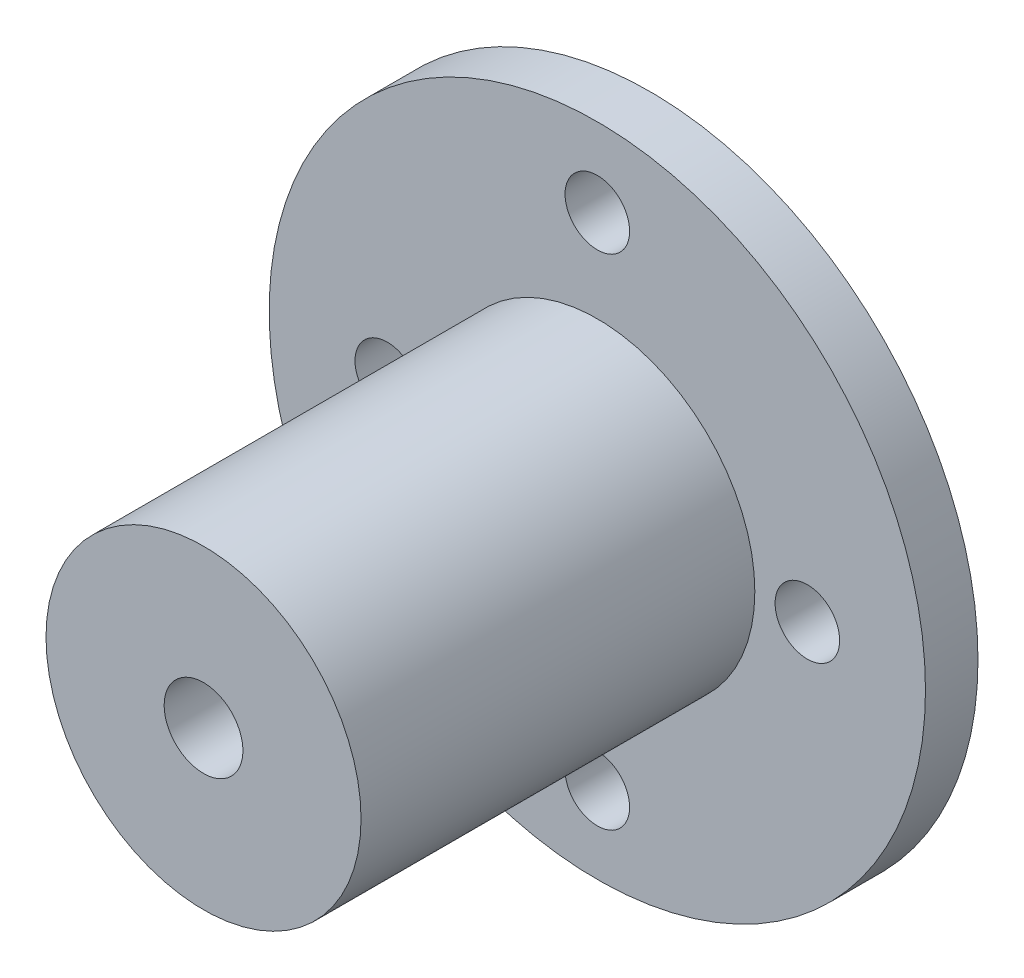
from build123d import *

# Parameters (mm, degrees)
ESQUISSE1_W                   = 12.5
ESQUISSE1_H                   = 2
ESQUISSE2_R                   = 6
BOSS_EXTRU_1_DEPTH            = 15
DIAM_TRE_DU_PER_AGE_3_0_3_1_D = 3
D_GAGEMENT_M21_D              = 2.459
D_GAGEMENT_M21_DEPTH          = 17


with BuildPart() as part:
    # Esquisse1 → Révolution1 (revolve)
    with BuildSketch(Plane(origin=(0, 152.70275651, 0), x_dir=(1, 0, 0), z_dir=(0, 1, 0))):
        with Locations((177.420752313, -1)):
            Rectangle(ESQUISSE1_W, ESQUISSE1_H)
    revolve(axis=Axis((171.170752313, 152.70275651, 0), (0, 0, 1)))

    # Esquisse2 → Boss.-Extru.1 (add)
    with BuildSketch(Plane.XY.offset(2)):
        with Locations((171.170752313, 152.70275651)):
            Circle(ESQUISSE2_R)
    extrude(amount=BOSS_EXTRU_1_DEPTH)

    # Diamètre du perçage Ø3.0 (3)1 (through all)
    with Locations(Plane(origin=(0, 0, 0), x_dir=(-1, 0, 0), z_dir=(0, 0, -1))):
        with Locations((-171.170752313, 152.70275651)):
            Hole(DIAM_TRE_DU_PER_AGE_3_0_3_1_D / 2)

    # Dégagement M21
    with Locations(Plane(origin=(0, 0, 0), x_dir=(-1, 0, 0), z_dir=(0, 0, -1))):
        with Locations((-179.170752313, 152.70275651), (-163.170752313, 152.70275651), (-171.170752313, 162.20275651), (-171.170752313, 143.20275651)):
            Hole(D_GAGEMENT_M21_D / 2, depth=D_GAGEMENT_M21_DEPTH)


solid = part.part
